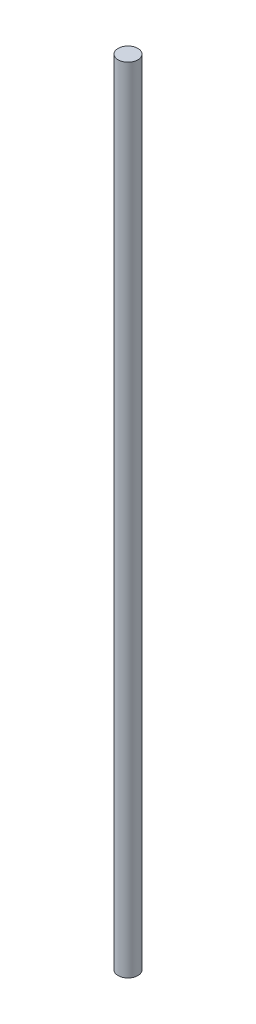
from build123d import *

# Parameters (mm, degrees)
SKETCH2_R           = 1.5
BOSS_EXTRUDE1_DEPTH = 120


with BuildPart() as part:
    # Sketch2 → Boss-Extrude1 (new body)
    with BuildSketch(Plane(origin=(0, 0, 0), x_dir=(1, 0, 0), z_dir=(0, 1, 0))):
        with Locations(Location((0, 0, 0), (0, 0, 270))):
            Circle(SKETCH2_R)
    extrude(amount=BOSS_EXTRUDE1_DEPTH)


solid = part.part
